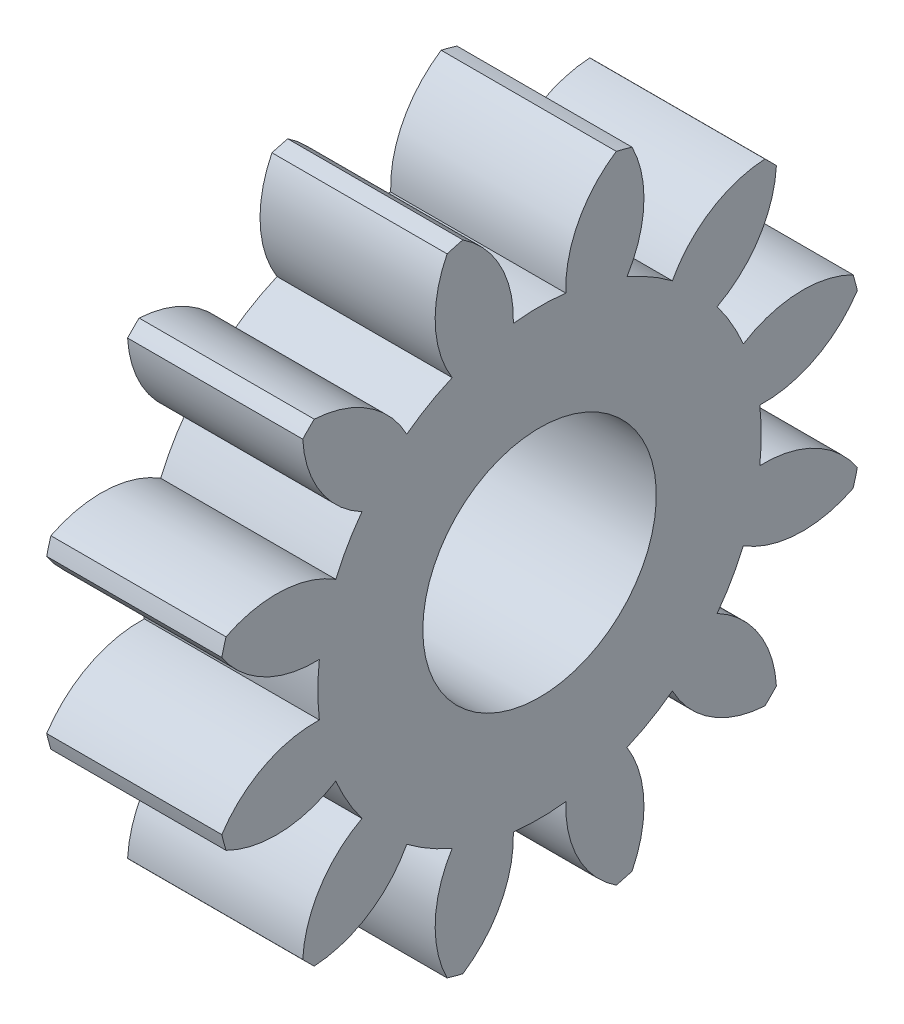
from build123d import *

# Parameters (mm, degrees)
BASPROSKE_W           = 12
BASPROSKE_H           = 5.6
TOOTHCUT_DEPTH        = 15.377760604
TEETHCUTS_COUNT       = 12
TEETHCUTS_ANGLE       = 330
BORSKE_R              = 2
BORE_DEPTH            = 50.0000508
CROQUIS1_W            = 12.415647279
CROQUIS1_H            = 11.755240509
CORTAR_EXTRUIR1_DEPTH = 9


with BuildPart() as part:
    # BasProSke → Base-Revolve (revolve)
    with BuildSketch(Plane(origin=(0, 0, 0), x_dir=(1, 0, 0), z_dir=(0, 1, 0)), mode=Mode.PRIVATE) as base_revolve_sk:
        with Locations((6, 2.8)):
            Rectangle(BASPROSKE_W, BASPROSKE_H)
    revolve(base_revolve_sk.sketch.rotate(Axis((-10, 0, 0), (1, 0, 0)), 180), axis=Axis((-10, 0, 0), (1, 0, 0)))

    # TooCutSke → ToothCut (cut, through all)
    with BuildSketch(Plane(origin=(0, 0, 0), x_dir=(0, 0, -1), z_dir=(1, 0, 0))):
        with BuildLine():
            ThreePointArc((0.449218713, 3.77234722), (0, 3.799), (-0.449218713, 3.77234722))
            ThreePointArc((-0.449218713, 3.77234722), (-0.670924606, 4.73673149), (-1.343429094, 5.462629717))
            ThreePointArc((-1.343429094, 5.462629717), (0, 5.6254), (1.343429094, 5.462629717))
            ThreePointArc((1.343429094, 5.462629717), (0.670924606, 4.73673149), (0.449218713, 3.77234722))
        make_face()
    toothcut = extrude(amount=TOOTHCUT_DEPTH, mode=Mode.SUBTRACT)

    # TeethCuts: ToothCut ×12 about axis
    teethcuts_axis = Axis((-10, 0, 0), (1, 0, 0))
    for i in range(1, TEETHCUTS_COUNT):
        add(toothcut.rotate(teethcuts_axis, i * TEETHCUTS_ANGLE / (TEETHCUTS_COUNT - 1)), mode=Mode.SUBTRACT)

    # BorSke → Bore (cut, symmetric)
    with BuildSketch(Plane(origin=(0, 0, 0), x_dir=(0, 0, -1), z_dir=(1, 0, 0))):
        with Locations(Location((0, 0, 0), (0, 0, 180))):
            Circle(BORSKE_R)
    extrude(amount=BORE_DEPTH, both=True, mode=Mode.SUBTRACT)

    # Croquis1 → Cortar-Extruir1 (cut)
    with BuildSketch(Plane.ZY):
        with Locations((0.242149149, 0.154094914)):
            Rectangle(CROQUIS1_W, CROQUIS1_H)
    extrude(amount=-CORTAR_EXTRUIR1_DEPTH, mode=Mode.SUBTRACT)


solid = part.part
